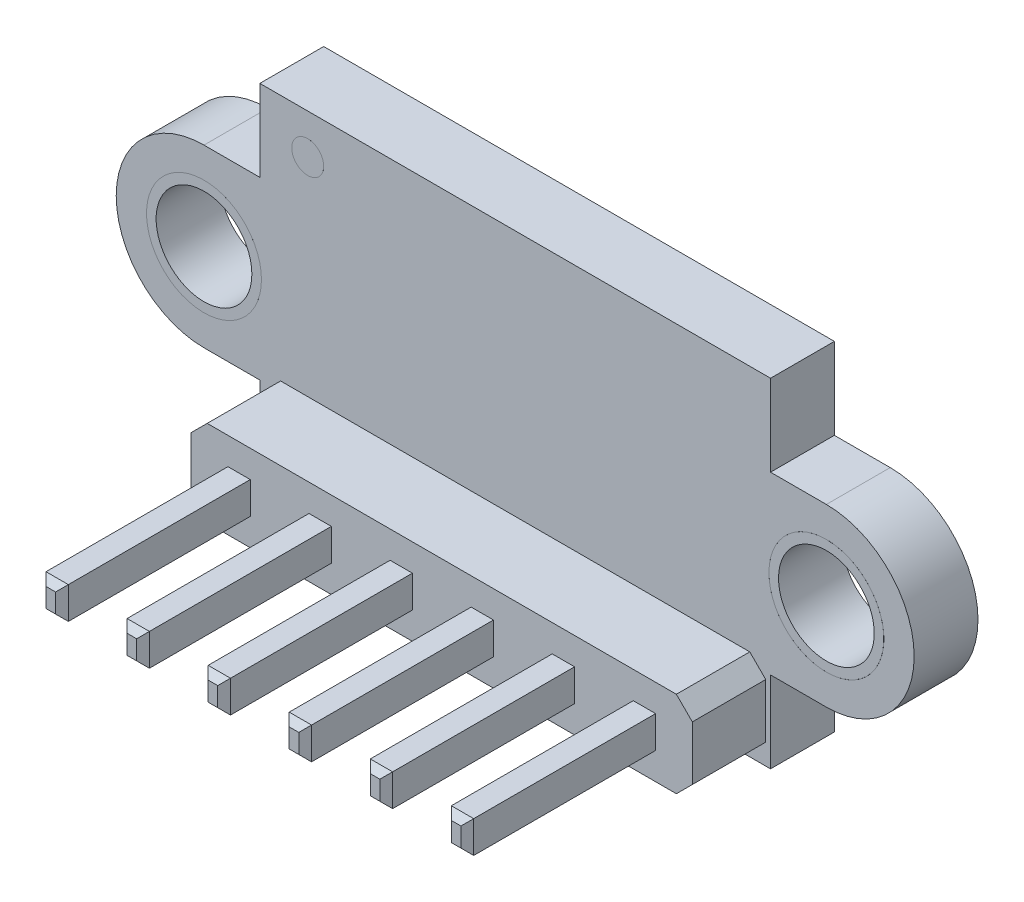
from build123d import *

# Parameters (mm, degrees)
SKETCH1_W                = 16
SKETCH1_H                = 10.6
BOSS_EXTRUDE1_DEPTH      = 1
SKETCH2_R                = 1.5
BOSS_EXTRUDE2_DEPTH      = 1
BOSS_EXTRUDE9_START      = 0.0001
SKETCH9_R                = 1.8
SKETCH9_R_2              = 1.5
SKETCH9_R_3              = 0.5
BOSS_EXTRUDE9_DEPTH      = 0.0001
SKETCH3_W                = 15.7
SKETCH3_H                = 2.7
BOSS_EXTRUDE3_DEPTH      = 2.3
CHAMFER1_SIZE            = 0.5
BOSS_EXTRUDE4_DEPTH      = 5.9
BOSS_EXTRUDE4_DEPTH_BACK = 6
SKETCH4_W                = 0.7
SKETCH4_H                = 1
CHAMFER3_SIZE            = 0.4
CHAMFER2_SIZE            = 0.2
SKETCH6_W                = 4.4
SKETCH6_H                = 2.4
BOSS_EXTRUDE6_DEPTH      = 1.2
SKETCH8_R                = 0.15
SKETCH8_R_2              = 0.05
CUT_EXTRUDE1_DEPTH       = 0.01
SKETCH5_W                = 4.8
SKETCH5_H                = 2.8
SKETCH5_W_2              = 4.6
SKETCH5_H_2              = 2.6
INSCRI_ES_DEPTH          = 0.0001


with BuildPart() as part:
    # Sketch1 → Boss-Extrude1 (new, symmetric)
    with BuildSketch(Plane.XY):
        Rectangle(SKETCH1_W, SKETCH1_H)
    extrude(amount=BOSS_EXTRUDE1_DEPTH, both=True)

    # Sketch2 → Boss-Extrude2 (add, symmetric)
    # profile 1 of 2: a face of its own
    with BuildSketch(Plane.XY):
        with BuildLine():
            Line((-9.75, 2.75), (-8, 2.75))
            Line((-8, 2.75), (-8, -2.75))
            Line((-8, -2.75), (-9.75, -2.75))
            ThreePointArc((-9.75, -2.75), (-12.5, 0), (-9.75, 2.75))
        make_face()
        with Locations((-9.75, 0)):
            Circle(SKETCH2_R, mode=Mode.SUBTRACT)
    # profile 2 of 2: a face of its own
    with BuildSketch(Plane.XY):
        with BuildLine():
            Line((9.75, -2.75), (8, -2.75))
            Line((8, -2.75), (8, 2.75))
            Line((8, 2.75), (9.75, 2.75))
            ThreePointArc((9.75, 2.75), (12.5, 0), (9.75, -2.75))
        make_face()
        with Locations(Location((9.75, 0, 0), (0, 0, 180))):
            Circle(SKETCH2_R, mode=Mode.SUBTRACT)
    extrude(amount=BOSS_EXTRUDE2_DEPTH, both=True)

    # Sketch9 → Boss-Extrude9 (add)
    # profile 1 of 3: a face of its own
    with BuildSketch(Plane(origin=(0, 0, -1), x_dir=(-1, 0, 0), z_dir=(0, 0, -1)).offset(BOSS_EXTRUDE9_START)):
        with Locations(Location((-9.75, 0, 0), (0, 0, 180))):
            Circle(SKETCH9_R)
        with Locations((-9.75, 0)):
            Circle(SKETCH9_R_2, mode=Mode.SUBTRACT)
    # profile 2 of 3: a face of its own
    with BuildSketch(Plane(origin=(0, 0, -1), x_dir=(-1, 0, 0), z_dir=(0, 0, -1)).offset(BOSS_EXTRUDE9_START)):
        with Locations(Location((9.75, 0, 0), (0, 0, 180))):
            Circle(SKETCH9_R)
        with Locations(Location((9.75, 0, 0), (0, 0, 180))):
            Circle(SKETCH9_R_2, mode=Mode.SUBTRACT)
    # profile 3 of 3: a face of its own
    with BuildSketch(Plane(origin=(0, 0, -1), x_dir=(-1, 0, 0), z_dir=(0, 0, -1)).offset(BOSS_EXTRUDE9_START)):
        with Locations(Location((6.5, 4.05, 0), (0, 0, 180))):
            Circle(SKETCH9_R_3)
    boss_extrude9 = extrude(amount=-BOSS_EXTRUDE9_DEPTH)

    # Mirror4: Boss-Extrude9 across plane
    add(boss_extrude9.mirror(Plane.XY))

    # Sketch3 → Boss-Extrude3 (add)
    with BuildSketch(Plane.XY.offset(1)):
        with Locations((0, -3.8)):
            Rectangle(SKETCH3_W, SKETCH3_H)
    extrude(amount=BOSS_EXTRUDE3_DEPTH)

    # Chamfer1
    chamfer1_edges = [part.edges().sort_by_distance(p)[0] for p in [
        (-7.85, -2.45, 2.15),
        (-7.85, -5.15, 2.15),
        (7.85, -5.15, 2.15),
        (7.85, -2.45, 2.15),
    ]]
    chamfer(chamfer1_edges, length=CHAMFER1_SIZE)

    # Sketch4 → Boss-Extrude4 (add, two sides: drawn at the far end of the back side and taken through both)
    with BuildSketch(Plane.XY.offset(3.3).offset(-BOSS_EXTRUDE4_DEPTH_BACK)):
        with Locations((-3.81, -3.8)):
            Rectangle(SKETCH4_W, SKETCH4_H)
        with Locations((-6.35, -3.8)):
            Rectangle(SKETCH4_W, SKETCH4_H)
        with Locations((-1.27, -3.8)):
            Rectangle(SKETCH4_W, SKETCH4_H)
        with Locations((1.27, -3.8)):
            Rectangle(SKETCH4_W, SKETCH4_H)
        with Locations((3.81, -3.8)):
            Rectangle(SKETCH4_W, SKETCH4_H)
        with Locations((6.35, -3.8)):
            Rectangle(SKETCH4_W, SKETCH4_H)
    extrude(amount=BOSS_EXTRUDE4_DEPTH + BOSS_EXTRUDE4_DEPTH_BACK)

    # Chamfer3
    chamfer3_edges = [part.edges().sort_by_distance(p)[0] for p in [
        (-6.7, -3.8, -1),
        (-6.35, -3.3, -1),
        (-6, -3.8, -1),
        (-6.35, -4.3, -1),
        (-4.16, -3.8, -1),
        (-3.81, -3.3, -1),
        (-3.46, -3.8, -1),
        (-3.81, -4.3, -1),
        (-1.62, -3.8, -1),
        (-1.27, -3.3, -1),
        (-0.92, -3.8, -1),
        (-1.27, -4.3, -1),
        (0.92, -3.8, -1),
        (1.27, -3.3, -1),
        (1.62, -3.8, -1),
        (1.27, -4.3, -1),
        (3.46, -3.8, -1),
        (3.81, -3.3, -1),
        (4.16, -3.8, -1),
        (3.81, -4.3, -1),
        (6, -3.8, -1),
        (6.35, -3.3, -1),
        (6.7, -3.8, -1),
        (6.35, -4.3, -1),
    ]]
    chamfer(chamfer3_edges, length=CHAMFER3_SIZE)

    # Chamfer2
    chamfer2_edges = [part.edges().sort_by_distance(p)[0] for p in [
        (-6.7, -3.8, -2.7),
        (-6.35, -3.3, -2.7),
        (-6, -3.8, -2.7),
        (-6.35, -4.3, -2.7),
        (-6.7, -3.8, 9.2),
        (-6.35, -4.3, 9.2),
        (-6, -3.8, 9.2),
        (-6.35, -3.3, 9.2),
        (-4.16, -3.8, -2.7),
        (-3.81, -3.3, -2.7),
        (-3.46, -3.8, -2.7),
        (-3.81, -4.3, -2.7),
        (-4.16, -3.8, 9.2),
        (-3.81, -4.3, 9.2),
        (-3.46, -3.8, 9.2),
        (-3.81, -3.3, 9.2),
        (-1.62, -3.8, -2.7),
        (-1.27, -3.3, -2.7),
        (-0.92, -3.8, -2.7),
        (-1.27, -4.3, -2.7),
        (-1.62, -3.8, 9.2),
        (-1.27, -4.3, 9.2),
        (-0.92, -3.8, 9.2),
        (-1.27, -3.3, 9.2),
        (0.92, -3.8, -2.7),
        (1.27, -3.3, -2.7),
        (1.62, -3.8, -2.7),
        (1.27, -4.3, -2.7),
        (0.92, -3.8, 9.2),
        (1.27, -4.3, 9.2),
        (1.62, -3.8, 9.2),
        (1.27, -3.3, 9.2),
        (3.46, -3.8, -2.7),
        (3.81, -3.3, -2.7),
        (4.16, -3.8, -2.7),
        (3.81, -4.3, -2.7),
        (3.46, -3.8, 9.2),
        (3.81, -4.3, 9.2),
        (4.16, -3.8, 9.2),
        (3.81, -3.3, 9.2),
        (6, -3.8, -2.7),
        (6.35, -3.3, -2.7),
        (6.7, -3.8, -2.7),
        (6.35, -4.3, -2.7),
        (6, -3.8, 9.2),
        (6.35, -4.3, 9.2),
        (6.7, -3.8, 9.2),
        (6.35, -3.3, 9.2),
    ]]
    chamfer(chamfer2_edges, length=CHAMFER2_SIZE)

    # Sketch6 → Boss-Extrude6 (add)
    with BuildSketch(Plane(origin=(0, 0, -1), x_dir=(-1, 0, 0), z_dir=(0, 0, -1))):
        with Locations((0, 2.1)):
            Rectangle(SKETCH6_W, SKETCH6_H)
    extrude(amount=BOSS_EXTRUDE6_DEPTH)

    # Sketch8 → Cut-Extrude1 (cut)
    with BuildSketch(Plane(origin=(0, 0, -2.2), x_dir=(-1, 0, 0), z_dir=(0, 0, -1))):
        with Locations((-1.55, 2.1)):
            Circle(SKETCH8_R)
        with Locations((1.65, 2.1)):
            Circle(SKETCH8_R_2)
    extrude(amount=-CUT_EXTRUDE1_DEPTH, mode=Mode.SUBTRACT)

    # Sketch5 → Inscrições (add)
    # profile 1 of 12: a face of its own
    with BuildSketch(Plane(origin=(0, 0, -1), x_dir=(-1, 0, 0), z_dir=(0, 0, -1))):
        with Locations((0, 2.1)):
            Rectangle(SKETCH5_W, SKETCH5_H)
        with Locations((0, 2.1)):
            Rectangle(SKETCH5_W_2, SKETCH5_H_2, mode=Mode.SUBTRACT)
    # profile 2 of 12: a face of its own
    with BuildSketch(Plane(origin=(0, 0, -1), x_dir=(-1, 0, 0), z_dir=(0, 0, -1))):
        Polygon((-3.145569905, 4.655439852), (-3.07345452, 4.655439852), (-2.82345452, 4.064394179), (-2.57345452, 4.655439852), (-2.501339136, 4.655439852), (-2.818646828, 3.905439852), (-2.828262213, 3.905439852), align=None)
    # profile 3 of 12: a face of its own
    with BuildSketch(Plane(origin=(0, 0, -1), x_dir=(-1, 0, 0), z_dir=(0, 0, -1))):
        Polygon((-2.366723751, 4.655439852), (-2.299416059, 4.655439852), (-2.299416059, 3.982362929), (-2.01095452, 3.982362929), (-2.01095452, 3.905439852), (-2.366723751, 3.905439852), align=None)
    # profile 4 of 12: a face of its own
    with BuildSketch(Plane(origin=(0, 0, -1), x_dir=(-1, 0, 0), z_dir=(0, 0, -1))):
        with BuildLine():
            Line((-1.482108366, 4.655439852), (-1.482108366, 4.578516775))
            Line((-1.482108366, 4.578516775), (-1.73721654, 4.578516775))
            Line((-1.73721654, 4.578516775), (-1.777631203, 4.38125115))
            add(Edge.make_bspline(
                [(-1.777631203, 4.38125115), (-1.769690658, 4.383443351), (-1.754307109, 4.387690394), (-1.731601425, 4.392405916), (-1.710045953, 4.395248511), (-1.696058373, 4.395636649), (-1.689289857, 4.395824467)],
                knots=[0, 0, 0, 0, 1.100273476, 2.13160584, 3.095893838, 4, 4, 4, 4], degree=3))
            add(Edge.make_bspline(
                [(-1.689289857, 4.395824467), (-1.68091477, 4.395643195), (-1.664447256, 4.395286769), (-1.640353196, 4.39186423), (-1.61735329, 4.386477106), (-1.59549564, 4.37895128), (-1.574739807, 4.369327765), (-1.555276758, 4.35730635), (-1.536814348, 4.343263493), (-1.519683793, 4.327118133), (-1.504142869, 4.309349215), (-1.490478729, 4.290243957), (-1.478872459, 4.26998803), (-1.469538012, 4.248387899), (-1.462084226, 4.225682366), (-1.457123084, 4.201632527), (-1.453819504, 4.176465073), (-1.453450421, 4.159256951), (-1.453262213, 4.150481919)],
                knots=[0, 0, 0, 0, 1.052922333, 2.070308379, 3.05430497, 4.020497103, 4.973039431, 5.925935799, 6.892292201, 7.88610001, 8.88166317, 9.857072816, 10.836096531, 11.812156883, 12.81219415, 13.836441305, 14.89672472, 16, 16, 16, 16], degree=3))
            add(Edge.make_bspline(
                [(-1.453262213, 4.150481919), (-1.453404729, 4.144370015), (-1.453687835, 4.132228803), (-1.455127532, 4.114197903), (-1.457899472, 4.096548725), (-1.461621127, 4.079278926), (-1.466451645, 4.062421204), (-1.472299299, 4.045927305), (-1.479455591, 4.029899889), (-1.487305171, 4.014187304), (-1.496143702, 3.999144767), (-1.505953382, 3.985077127), (-1.516317416, 3.971773353), (-1.527469142, 3.959376124), (-1.539512212, 3.947966906), (-1.552300776, 3.937477989), (-1.565732788, 3.927731989), (-1.580016054, 3.919124519), (-1.5948323, 3.911203885), (-1.61039549, 3.904705985), (-1.626351354, 3.898896586), (-1.642929542, 3.894265973), (-1.660092501, 3.890637568), (-1.677868525, 3.888173154), (-1.696164383, 3.886378203), (-1.708566171, 3.886265841), (-1.714830722, 3.886209083)],
                knots=[0, 0, 0, 0, 1.056347294, 2.098418968, 3.122841568, 4.141288669, 5.149314143, 6.15115421, 7.162517403, 8.180376062, 9.185164535, 10.17417709, 11.141909838, 12.097768115, 13.052685741, 14.0056014, 14.954263652, 15.917497458, 16.885230207, 17.854509472, 18.828990115, 19.81800267, 20.826176721, 21.857883937, 22.917946725, 24, 24, 24, 24], degree=3))
            add(Edge.make_bspline(
                [(-1.714830722, 3.886209083), (-1.722303761, 3.886357119), (-1.737006082, 3.886648364), (-1.758546203, 3.889695182), (-1.779270762, 3.894058879), (-1.799012926, 3.900623794), (-1.817949626, 3.908849643), (-1.835825922, 3.919245965), (-1.853098589, 3.931027202), (-1.869065454, 3.944930134), (-1.883884621, 3.960126352), (-1.897150301, 3.976617275), (-1.908964639, 3.994130727), (-1.919138442, 4.01275176), (-1.927816589, 4.032431445), (-1.934634087, 4.053243517), (-1.940136592, 4.075079232), (-1.942464467, 4.090112127), (-1.943646828, 4.097747544)],
                knots=[0, 0, 0, 0, 1.0467383, 2.05933395, 3.04377827, 4.011590433, 4.970194871, 5.932262533, 6.905835911, 7.896367577, 8.894135286, 9.877477877, 10.858688626, 11.851381753, 12.8477658, 13.868841284, 14.917554742, 16, 16, 16, 16], degree=3))
            Line((-1.943646828, 4.097747544), (-1.876339136, 4.097747544))
            add(Edge.make_bspline(
                [(-1.876339136, 4.097747544), (-1.874683016, 4.090595447), (-1.871499863, 4.07684872), (-1.864512917, 4.057534861), (-1.855970229, 4.040323599), (-1.845812154, 4.024987259), (-1.833694291, 4.011613903), (-1.819866556, 3.999695961), (-1.804363472, 3.988944148), (-1.787136352, 3.979982126), (-1.76896212, 3.972338822), (-1.749940575, 3.967249173), (-1.730589644, 3.96367041), (-1.717501422, 3.963312176), (-1.710924472, 3.96313216)],
                knots=[0, 0, 0, 0, 1.136247022, 2.183929868, 3.172523383, 4.106158343, 5.02341133, 5.958108904, 6.928429099, 7.938127109, 8.96079061, 9.975095812, 10.982467395, 12, 12, 12, 12], degree=3))
            add(Edge.make_bspline(
                [(-1.710924472, 3.96313216), (-1.704504806, 3.963308041), (-1.691864429, 3.963654352), (-1.673261989, 3.966319854), (-1.655302088, 3.970425048), (-1.63816194, 3.976568588), (-1.62154161, 3.984035314), (-1.605861516, 3.993617116), (-1.590668043, 4.004644263), (-1.576433443, 4.017277826), (-1.563396418, 4.031199904), (-1.551877249, 4.046087916), (-1.542282196, 4.061970098), (-1.534196316, 4.078571488), (-1.528056323, 4.096074036), (-1.523676113, 4.114395716), (-1.521104029, 4.133581783), (-1.520750204, 4.146668064), (-1.520569905, 4.153336487)],
                knots=[0, 0, 0, 0, 1.027316725, 2.022795036, 3.002884548, 3.971462791, 4.93288096, 5.914575861, 6.907176829, 7.935150275, 8.956128384, 9.956726525, 10.942570165, 11.921478529, 12.907843606, 13.90538589, 14.932640048, 16, 16, 16, 16], degree=3))
            add(Edge.make_bspline(
                [(-1.520569905, 4.153336487), (-1.520711008, 4.159352719), (-1.520987196, 4.171128638), (-1.523243747, 4.188357039), (-1.527168812, 4.204658406), (-1.532616787, 4.220111456), (-1.539533824, 4.234730765), (-1.547986605, 4.248531421), (-1.558133762, 4.261331528), (-1.569724881, 4.273137075), (-1.582423033, 4.284032405), (-1.596446692, 4.293320424), (-1.61150239, 4.30113412), (-1.627408733, 4.307877263), (-1.644544069, 4.31272028), (-1.662569061, 4.316356255), (-1.681678356, 4.318459547), (-1.694743503, 4.318751381), (-1.701459328, 4.31890139)],
                knots=[0, 0, 0, 0, 1.045622112, 2.046656509, 3.013763289, 3.955457236, 4.890082067, 5.820317437, 6.762574623, 7.722996705, 8.69280354, 9.665887285, 10.63943826, 11.638615906, 12.663482002, 13.728887084, 14.832589034, 16, 16, 16, 16], degree=3))
            add(Edge.make_bspline(
                [(-1.701459328, 4.31890139), (-1.70727267, 4.318776978), (-1.719275746, 4.318520098), (-1.73768778, 4.316628706), (-1.757036007, 4.313577428), (-1.777246256, 4.309380375), (-1.798379222, 4.303888002), (-1.820390308, 4.297306323), (-1.843325793, 4.289437323), (-1.858779591, 4.283494706), (-1.866723751, 4.280439852)],
                knots=[0, 0, 0, 0, 0.817624296, 1.688186739, 2.600797293, 3.572016777, 4.590301741, 5.671205678, 6.80286297, 8, 8, 8, 8], degree=3))
            Line((-1.866723751, 4.280439852), (-1.789800674, 4.655439852))
            Line((-1.789800674, 4.655439852), (-1.482108366, 4.655439852))
        make_face()
    # profile 5 of 12: a face of its own
    with BuildSketch(Plane(origin=(0, 0, -1), x_dir=(-1, 0, 0), z_dir=(0, 0, -1))):
        with BuildLine():
            Line((-1.28018529, 4.482362929), (-1.347492982, 4.482362929))
            add(Edge.make_bspline(
                [(-1.347492982, 4.482362929), (-1.345669507, 4.489912747), (-1.342104762, 4.504672023), (-1.334669568, 4.525759294), (-1.326569727, 4.545714334), (-1.316843491, 4.564163493), (-1.306234472, 4.581477543), (-1.294079603, 4.597263784), (-1.280939662, 4.611923705), (-1.266405745, 4.624933685), (-1.251163889, 4.636714627), (-1.234999327, 4.646759282), (-1.218237279, 4.655400172), (-1.200761607, 4.662518793), (-1.182520285, 4.667881405), (-1.163678223, 4.671772149), (-1.144186044, 4.674298817), (-1.130954417, 4.674545409), (-1.12423577, 4.674670621)],
                knots=[0, 0, 0, 0, 1.162005537, 2.271625781, 3.343758855, 4.383309926, 5.390229558, 6.379919256, 7.361854164, 8.333198761, 9.295911338, 10.242430842, 11.177959212, 12.116337295, 13.062827104, 14.020064771, 14.994644689, 16, 16, 16, 16], degree=3))
            add(Edge.make_bspline(
                [(-1.12423577, 4.674670621), (-1.114446611, 4.674375072), (-1.095081823, 4.67379042), (-1.066632599, 4.668451612), (-1.03919828, 4.660003369), (-1.013079156, 4.648330428), (-0.988818063, 4.633933147), (-0.967231738, 4.616797846), (-0.948612771, 4.597255138), (-0.932992547, 4.575669589), (-0.92076219, 4.552600551), (-0.911743682, 4.52885766), (-0.906253321, 4.504497238), (-0.905541774, 4.488049249), (-0.90518529, 4.479808842)],
                knots=[0, 0, 0, 0, 1.083050992, 2.142477498, 3.193116406, 4.255571735, 5.30263384, 6.308962982, 7.297363603, 8.282367274, 9.249857812, 10.179914175, 11.08814088, 12, 12, 12, 12], degree=3))
            add(Edge.make_bspline(
                [(-0.90518529, 4.479808842), (-0.90543463, 4.471878815), (-0.905922552, 4.456360982), (-0.910065489, 4.433706375), (-0.917037545, 4.412354604), (-0.926695351, 4.392215783), (-0.939197112, 4.373417603), (-0.954341262, 4.35591777), (-0.972234689, 4.339638664), (-0.985794462, 4.330313063), (-0.992775434, 4.325511967)],
                knots=[0, 0, 0, 0, 1.024540389, 2.004866551, 2.965041327, 3.920577974, 4.882998113, 5.874504559, 6.905732034, 8, 8, 8, 8], degree=3))
            add(Edge.make_bspline(
                [(-0.992775434, 4.325511967), (-0.984797201, 4.321659502), (-0.968990013, 4.314026654), (-0.947443471, 4.299057563), (-0.927883927, 4.28177406), (-0.916975987, 4.268286349), (-0.911495386, 4.261509563)],
                knots=[0, 0, 0, 0, 1.015518401, 2.012035669, 3.001164323, 4, 4, 4, 4], degree=3))
            add(Edge.make_bspline(
                [(-0.911495386, 4.261509563), (-0.907886527, 4.256568617), (-0.900727906, 4.246767635), (-0.89189172, 4.231009829), (-0.883875481, 4.215077367), (-0.877629006, 4.198543209), (-0.872791749, 4.181598991), (-0.869334027, 4.164215621), (-0.867185997, 4.146378902), (-0.866878379, 4.134311942), (-0.866723751, 4.128246342)],
                knots=[0, 0, 0, 0, 1.025084078, 2.033381695, 3.024893161, 4.013698104, 4.991890475, 5.976764909, 6.982997093, 8, 8, 8, 8], degree=3))
            add(Edge.make_bspline(
                [(-0.866723751, 4.128246342), (-0.86710829, 4.117744259), (-0.867875557, 4.096789516), (-0.874733573, 4.065830647), (-0.885364982, 4.035568039), (-0.900462897, 4.006623431), (-0.918863077, 3.979541921), (-0.940753932, 3.955311283), (-0.965886734, 3.934483011), (-0.993916516, 3.917080819), (-1.024284472, 3.903169836), (-1.056764956, 3.893514669), (-1.090889968, 3.887226241), (-1.114291532, 3.886551912), (-1.126188895, 3.886209083)],
                knots=[0, 0, 0, 0, 0.955779014, 1.907060117, 2.875433937, 3.871313158, 4.872415639, 5.851225146, 6.836215519, 7.83643374, 8.849228613, 9.86973379, 10.916971861, 12, 12, 12, 12], degree=3))
            add(Edge.make_bspline(
                [(-1.126188895, 3.886209083), (-1.134207317, 3.886395128), (-1.149984896, 3.886761204), (-1.173179932, 3.889263762), (-1.195320296, 3.893834477), (-1.216435924, 3.899985185), (-1.236545575, 3.907783416), (-1.255587883, 3.917494565), (-1.273680003, 3.928918459), (-1.290651207, 3.942189942), (-1.306499471, 3.957035943), (-1.320803627, 3.973720017), (-1.333802154, 3.991933746), (-1.345147005, 4.011888687), (-1.355354923, 4.033326956), (-1.363750842, 4.056523063), (-1.371140607, 4.081269639), (-1.37457635, 4.098514869), (-1.376339136, 4.107362929)],
                knots=[0, 0, 0, 0, 1.048658725, 2.063410685, 3.046034179, 4.001477787, 4.936774919, 5.862367409, 6.792675028, 7.730719943, 8.675894397, 9.627829632, 10.600096036, 11.597688215, 12.626045268, 13.701542398, 14.82072376, 16, 16, 16, 16], degree=3))
            Line((-1.376339136, 4.107362929), (-1.309031443, 4.107362929))
            add(Edge.make_bspline(
                [(-1.309031443, 4.107362929), (-1.307277881, 4.10158814), (-1.30386705, 4.090355675), (-1.298061129, 4.074189895), (-1.291446499, 4.059370312), (-1.284350522, 4.045788215), (-1.276897998, 4.033309843), (-1.268559085, 4.022265157), (-1.259951411, 4.012169042), (-1.253462979, 4.006480911), (-1.250287453, 4.003697063)],
                knots=[0, 0, 0, 0, 1.198163088, 2.33053128, 3.407730985, 4.417276592, 5.372219308, 6.28897303, 7.162600585, 8, 8, 8, 8], degree=3))
            add(Edge.make_bspline(
                [(-1.250287453, 4.003697063), (-1.246088187, 4.000459563), (-1.237702616, 3.993994557), (-1.224037995, 3.985744208), (-1.209666948, 3.978595416), (-1.194278089, 3.973134624), (-1.178203496, 3.96851084), (-1.161183346, 3.965485014), (-1.143367799, 3.963408978), (-1.131203279, 3.963225778), (-1.124986972, 3.96313216)],
                knots=[0, 0, 0, 0, 0.946170439, 1.889420265, 2.845303464, 3.807233317, 4.801018734, 5.828864929, 6.890507805, 8, 8, 8, 8], degree=3))
            add(Edge.make_bspline(
                [(-1.124986972, 3.96313216), (-1.117968365, 3.963264139), (-1.104244083, 3.963522214), (-1.084218042, 3.96589558), (-1.065166446, 3.969352097), (-1.047300819, 3.974690593), (-1.030387139, 3.98128649), (-1.0146625, 3.989568291), (-0.999920477, 3.999285017), (-0.98634989, 4.010329123), (-0.974147281, 4.022419443), (-0.9634031, 4.035065101), (-0.954269244, 4.048212779), (-0.946901334, 4.061935234), (-0.941083359, 4.07617564), (-0.937122673, 4.09097396), (-0.934368777, 4.106209089), (-0.934144503, 4.116565296), (-0.934031443, 4.121786006)],
                knots=[0, 0, 0, 0, 1.217147791, 2.380027433, 3.494444702, 4.572153297, 5.609568379, 6.639424714, 7.649109417, 8.668170816, 9.669597737, 10.625200337, 11.543417969, 12.441394052, 13.322311151, 14.205496177, 15.095365482, 16, 16, 16, 16], degree=3))
            add(Edge.make_bspline(
                [(-0.934031443, 4.121786006), (-0.934359365, 4.12877415), (-0.935013577, 4.142715666), (-0.940008273, 4.163226575), (-0.948223743, 4.182988734), (-0.959724996, 4.201664975), (-0.973725509, 4.218974097), (-0.990089418, 4.234417986), (-1.00895261, 4.247161577), (-1.02631401, 4.255966289), (-1.041692258, 4.261974234), (-1.054852697, 4.265976012), (-1.069586255, 4.269364652), (-1.085714759, 4.272517282), (-1.103359734, 4.275200428), (-1.12250197, 4.27743796), (-1.143145348, 4.279228326), (-1.157436312, 4.280027846), (-1.164800674, 4.280439852)],
                knots=[0, 0, 0, 0, 1.07054697, 2.135767047, 3.216561865, 4.33974944, 5.486079747, 6.621378074, 7.775625952, 8.963672916, 9.598146892, 10.304877434, 11.070270905, 11.915000392, 12.823868403, 13.805723172, 14.86925407, 16, 16, 16, 16], degree=3))
            Line((-1.164800674, 4.280439852), (-1.164800674, 4.357362929))
            add(Edge.make_bspline(
                [(-1.164800674, 4.357362929), (-1.155521853, 4.357520387), (-1.137346922, 4.357828808), (-1.110798142, 4.361559096), (-1.085411004, 4.366719231), (-1.06174813, 4.3746232), (-1.040180549, 4.383803264), (-1.021469206, 4.39448588), (-1.005876245, 4.40636047), (-0.993477444, 4.419610314), (-0.984149753, 4.433820682), (-0.977329725, 4.448631394), (-0.973301083, 4.464172264), (-0.972763297, 4.474778265), (-0.972492982, 4.480109323)],
                knots=[0, 0, 0, 0, 1.321986639, 2.589447074, 3.816329219, 5.01088745, 6.139805852, 7.153945165, 8.075214402, 8.924034688, 9.728124013, 10.488707548, 11.240355623, 12, 12, 12, 12], degree=3))
            add(Edge.make_bspline(
                [(-0.972492982, 4.480109323), (-0.972581784, 4.484025983), (-0.972758452, 4.491817991), (-0.97498644, 4.503201935), (-0.978334449, 4.514237852), (-0.982937248, 4.524878811), (-0.989098005, 4.535051013), (-0.996470717, 4.54484118), (-1.005249595, 4.554193419), (-1.015309334, 4.56291063), (-1.026111863, 4.571218324), (-1.037951101, 4.578271246), (-1.050470074, 4.584302331), (-1.063682643, 4.589275795), (-1.077631685, 4.593017071), (-1.092251662, 4.595703323), (-1.107570451, 4.59738282), (-1.118021537, 4.597624624), (-1.123334328, 4.597747544)],
                knots=[0, 0, 0, 0, 0.884392785, 1.759457502, 2.611959086, 3.489218968, 4.37281399, 5.2945488, 6.255912374, 7.266815255, 8.301784654, 9.332968512, 10.37626691, 11.440494194, 12.520033166, 13.637162961, 14.798855837, 16, 16, 16, 16], degree=3))
            add(Edge.make_bspline(
                [(-1.123334328, 4.597747544), (-1.131873971, 4.597449395), (-1.14855388, 4.596867041), (-1.172599934, 4.591766395), (-1.194954077, 4.583628234), (-1.212040934, 4.573914016), (-1.224658629, 4.564324637), (-1.233675115, 4.55594984), (-1.24252951, 4.546642807), (-1.250639298, 4.535830298), (-1.258840865, 4.524244557), (-1.266307557, 4.511296625), (-1.273563205, 4.497324255), (-1.27793518, 4.487446619), (-1.28018529, 4.482362929)],
                knots=[0, 0, 0, 0, 1.472543308, 2.876219568, 4.221790263, 5.565193594, 6.249813518, 6.953379497, 7.687249741, 8.463570142, 9.283606569, 10.136032583, 11.040678096, 12, 12, 12, 12], degree=3))
        make_face()
    # profile 6 of 12: a face of its own
    with BuildSketch(Plane(origin=(0, 0, -1), x_dir=(-1, 0, 0), z_dir=(0, 0, -1))):
        Polygon((-0.732108366, 4.655439852), (-0.664800674, 4.655439852), (-0.664800674, 3.982362929), (-0.376339136, 3.982362929), (-0.376339136, 3.905439852), (-0.732108366, 3.905439852), align=None)
    # profile 7 of 12: a face of its own
    with BuildSketch(Plane(origin=(0, 0, -1), x_dir=(-1, 0, 0), z_dir=(0, 0, -1))):
        with BuildLine():
            add(Edge.make_bspline(
                [(-0.318646828, 4.280139371), (-0.318576538, 4.29216024), (-0.31844, 4.315510951), (-0.316921052, 4.349536231), (-0.314397765, 4.381456293), (-0.310939756, 4.411272665), (-0.306731618, 4.438993043), (-0.301114013, 4.464543348), (-0.294725556, 4.488041835), (-0.28732146, 4.509565131), (-0.278966934, 4.52940321), (-0.269873878, 4.547922896), (-0.259681422, 4.565096167), (-0.248972084, 4.581197122), (-0.237312354, 4.5959622), (-0.225034042, 4.609599913), (-0.211657926, 4.621795074), (-0.197638709, 4.632904996), (-0.182849467, 4.642644169), (-0.167711753, 4.651222613), (-0.152121373, 4.658551156), (-0.136035762, 4.664313392), (-0.1195995, 4.669072859), (-0.102755129, 4.672327633), (-0.085474836, 4.674375542), (-0.073810957, 4.674571328), (-0.067895626, 4.674670621)],
                knots=[0, 0, 0, 0, 1.646270934, 3.197905019, 4.663502075, 6.030701355, 7.308322542, 8.50163776, 9.611534131, 10.641858119, 11.616356847, 12.558055219, 13.465016945, 14.349605745, 15.204443733, 16.039544428, 16.859896111, 17.680448484, 18.487036065, 19.28249412, 20.06191084, 20.843045899, 21.620316918, 22.403196591, 23.190181807, 24, 24, 24, 24], degree=3))
            add(Edge.make_bspline(
                [(-0.067895626, 4.674670621), (-0.061930881, 4.674566089), (-0.050068879, 4.674358208), (-0.032531656, 4.672360221), (-0.015399581, 4.66904498), (0.001254306, 4.664347628), (0.017566803, 4.658519983), (0.033410319, 4.651215601), (0.048883265, 4.642712987), (0.063739755, 4.632722156), (0.078142887, 4.621583097), (0.091738879, 4.608991096), (0.104528969, 4.595073299), (0.116673677, 4.579978614), (0.127828448, 4.563417524), (0.138451327, 4.545678072), (0.14795962, 4.52645003), (0.15711705, 4.506054215), (0.165021405, 4.483926289), (0.172149886, 4.460190983), (0.177909665, 4.434567943), (0.182707366, 4.407191604), (0.186424129, 4.377961429), (0.189131124, 4.346940076), (0.190561071, 4.314107135), (0.190830364, 4.291659025), (0.190968557, 4.280139371)],
                knots=[0, 0, 0, 0, 0.810914788, 1.612654377, 2.396697861, 3.181598691, 3.963628158, 4.749916497, 5.551656086, 6.361998678, 7.18212741, 8.025565596, 8.878627764, 9.750805457, 10.657531673, 11.591944965, 12.560506719, 13.57287815, 14.630710178, 15.753379473, 16.941251878, 18.199788006, 19.531962791, 20.947069417, 22.433333509, 24, 24, 24, 24], degree=3))
            add(Edge.make_bspline(
                [(0.190968557, 4.280139371), (0.190828931, 4.268669962), (0.190556877, 4.246322287), (0.189147154, 4.213637078), (0.186370305, 4.182780354), (0.182896736, 4.153678112), (0.178085815, 4.12645148), (0.172170422, 4.101006241), (0.165602496, 4.077232511), (0.15749504, 4.055325052), (0.148621317, 4.034978254), (0.138966632, 4.015978151), (0.128623098, 3.998156802), (0.117354081, 3.981656856), (0.105342635, 3.96636143), (0.09233168, 3.952540511), (0.078687984, 3.939861081), (0.064242466, 3.928578589), (0.049154276, 3.918703274), (0.033734474, 3.909871735), (0.017709463, 3.902750443), (0.001442402, 3.896635791), (-0.015299391, 3.891964266), (-0.032495046, 3.888734154), (-0.050057096, 3.886468758), (-0.06192886, 3.886295941), (-0.067895626, 3.886209083)],
                knots=[0, 0, 0, 0, 1.561518951, 3.042555995, 4.452378317, 5.7783523, 7.031515105, 8.214008947, 9.334062868, 10.386615937, 11.391082383, 12.354592575, 13.286541444, 14.194233754, 15.072674879, 15.931287219, 16.775624067, 17.606195743, 18.42308326, 19.229000347, 20.022332153, 20.807536673, 21.593273796, 22.3848459, 23.188221202, 24, 24, 24, 24], degree=3))
            add(Edge.make_bspline(
                [(-0.067895626, 3.886209083), (-0.073810793, 3.886309016), (-0.085474349, 3.886506065), (-0.102757011, 3.888544722), (-0.119531821, 3.89182233), (-0.135881554, 3.896411602), (-0.151890093, 3.902029067), (-0.167339297, 3.909347713), (-0.182400943, 3.917776442), (-0.197034848, 3.927375461), (-0.210966026, 3.938372965), (-0.22427287, 3.950536741), (-0.236621088, 3.964170329), (-0.248114108, 3.979058455), (-0.259037127, 3.99506415), (-0.26908485, 4.012405944), (-0.278378605, 4.031015075), (-0.286873638, 4.05101177), (-0.294405495, 4.072687826), (-0.301058575, 4.096291222), (-0.306311609, 4.122030287), (-0.310807956, 4.149698294), (-0.31443461, 4.179414136), (-0.316910537, 4.211193946), (-0.318440819, 4.245017919), (-0.318576905, 4.268218585), (-0.318646828, 4.280139371)],
                knots=[0, 0, 0, 0, 0.810891512, 1.598919785, 2.382837074, 3.152667961, 3.926044502, 4.706494248, 5.493654104, 6.291793342, 7.103789334, 7.925228297, 8.761435821, 9.622817696, 10.50288917, 11.416980706, 12.369136599, 13.353924996, 14.394355917, 15.514179734, 16.714354668, 17.994756427, 19.357759367, 20.818452758, 22.365282078, 24, 24, 24, 24], degree=3))
        make_face()
        with BuildLine():
            add(Edge.make_bspline(
                [(-0.251339136, 4.280439852), (-0.25131354, 4.270422274), (-0.251263863, 4.250980121), (-0.249966106, 4.222727994), (-0.248198199, 4.196377209), (-0.245917921, 4.171894308), (-0.242531575, 4.149362163), (-0.238737264, 4.128625802), (-0.234119816, 4.109794966), (-0.228656598, 4.092740435), (-0.222433934, 4.077172777), (-0.21563982, 4.062686803), (-0.208341094, 4.049111388), (-0.200172705, 4.036568472), (-0.19127662, 4.025017151), (-0.181853778, 4.014252972), (-0.17155251, 4.004653619), (-0.157301708, 3.993140722), (-0.138488178, 3.981243764), (-0.114783795, 3.970883888), (-0.09042627, 3.964373362), (-0.073893859, 3.963545414), (-0.06564202, 3.96313216)],
                knots=[0, 0, 0, 0, 1.459021318, 2.831673884, 4.118529203, 5.306027144, 6.411944654, 7.436330062, 8.375795394, 9.233974572, 10.042671642, 10.816086306, 11.563610507, 12.285937304, 12.993564865, 13.685989202, 14.367179055, 15.041617293, 16.353048772, 17.594441528, 18.799311195, 20, 20, 20, 20], degree=3))
            add(Edge.make_bspline(
                [(-0.06564202, 3.96313216), (-0.057336805, 3.963474541), (-0.040743521, 3.964158598), (-0.016500565, 3.970758327), (0.007034493, 3.980716085), (0.02547848, 3.992490551), (0.039510453, 4.003703764), (0.049564094, 4.013264046), (0.058791676, 4.023968875), (0.067543549, 4.035518724), (0.075570494, 4.048134256), (0.082869738, 4.061754808), (0.089530455, 4.076418203), (0.093325251, 4.086654576), (0.095265432, 4.091888169)],
                knots=[0, 0, 0, 0, 1.353760809, 2.704726607, 4.075137775, 5.516104923, 6.260822281, 7.007110065, 7.778089737, 8.566572457, 9.372053459, 10.217411131, 11.088608312, 12, 12, 12, 12], degree=3))
            add(Edge.make_bspline(
                [(0.095265432, 4.091888169), (0.097526525, 4.098580256), (0.102117513, 4.112168063), (0.108034322, 4.133245988), (0.112694051, 4.155360866), (0.1168862, 4.178380534), (0.119747569, 4.202474756), (0.122050672, 4.227568981), (0.123407248, 4.25368213), (0.123575409, 4.271423914), (0.123660864, 4.280439852)],
                knots=[0, 0, 0, 0, 0.884706709, 1.796334032, 2.740027952, 3.714592787, 4.726048262, 5.777819803, 6.87074269, 8, 8, 8, 8], degree=3))
            add(Edge.make_bspline(
                [(0.123660864, 4.280439852), (0.123542967, 4.289454332), (0.123312334, 4.307088581), (0.122430765, 4.332913906), (0.120154284, 4.357442712), (0.117625902, 4.38078067), (0.113897926, 4.402798592), (0.109878396, 4.4236808), (0.104478136, 4.443168591), (0.098709613, 4.461567073), (0.092107385, 4.478667213), (0.084839728, 4.494548739), (0.077077922, 4.509288323), (0.068647442, 4.522845525), (0.059648367, 4.53528107), (0.049843178, 4.546345626), (0.039620813, 4.556382119), (0.025302844, 4.567838384), (0.006558354, 4.579519461), (-0.016765714, 4.590269267), (-0.041037995, 4.596442472), (-0.057446592, 4.597312834), (-0.06564202, 4.597747544)],
                knots=[0, 0, 0, 0, 1.31362396, 2.569729283, 3.763502607, 4.902122613, 5.988968491, 7.01645872, 7.998833611, 8.933434873, 9.825090667, 10.667526885, 11.477055099, 12.250526234, 12.991942729, 13.710640831, 14.402115721, 15.076753259, 16.378508321, 17.609869233, 18.806226677, 20, 20, 20, 20], degree=3))
            add(Edge.make_bspline(
                [(-0.06564202, 4.597747544), (-0.073937147, 4.597312234), (-0.090542513, 4.596440821), (-0.115067074, 4.590292267), (-0.13857515, 4.579575203), (-0.157270073, 4.567799694), (-0.171598027, 4.556584342), (-0.181687176, 4.546858673), (-0.19114707, 4.53622019), (-0.199861577, 4.524562637), (-0.208023566, 4.512034344), (-0.215519497, 4.498536751), (-0.222273211, 4.484001459), (-0.228505612, 4.468440794), (-0.233985495, 4.451387735), (-0.23850563, 4.432580093), (-0.242681427, 4.411909688), (-0.245637556, 4.389255508), (-0.248265504, 4.364766475), (-0.249954364, 4.338349907), (-0.251268205, 4.310050397), (-0.251315018, 4.29050772), (-0.251339136, 4.280439852)],
                knots=[0, 0, 0, 0, 1.207732386, 2.417664972, 3.655092373, 4.956220595, 5.625982001, 6.301752483, 6.994047911, 7.697131622, 8.419323945, 9.170223765, 9.943494443, 10.752040957, 11.610060368, 12.549350801, 13.567764191, 14.679664412, 15.874934091, 17.154273443, 18.533957287, 20, 20, 20, 20], degree=3))
        make_face(mode=Mode.SUBTRACT)
    # profile 8 of 12: a face of its own
    with BuildSketch(Plane(origin=(0, 0, -1), x_dir=(-1, 0, 0), z_dir=(0, 0, -1))):
        Polygon((0.652507018, 4.674670621), (0.338805095, 3.799670621), (0.267891634, 3.799670621), (0.581593557, 4.674670621), align=None)
    # profile 9 of 12: a face of its own
    with BuildSketch(Plane(origin=(0, 0, -1), x_dir=(-1, 0, 0), z_dir=(0, 0, -1))):
        Polygon((0.869604374, 4.655439852), (1.008276249, 4.655439852), (1.008276249, 3.905439852), (0.940968557, 3.905439852), (0.940968557, 4.578516775), (0.825583941, 4.578516775), align=None)
    # profile 10 of 12: a face of its own
    with BuildSketch(Plane(origin=(0, 0, -1), x_dir=(-1, 0, 0), z_dir=(0, 0, -1))):
        Polygon((1.30154548, 4.655439852), (1.379219759, 4.655439852), (1.575583941, 4.348648987), (1.771948124, 4.655439852), (1.849622403, 4.655439852), (1.614496201, 4.287951871), (1.859237787, 3.905439852), (1.781563509, 3.905439852), (1.575583941, 4.227254756), (1.369604374, 3.905439852), (1.291930095, 3.905439852), (1.536821922, 4.287951871), align=None)
    # profile 11 of 12: a face of its own
    with BuildSketch(Plane(origin=(0, 0, -1), x_dir=(-1, 0, 0), z_dir=(0, 0, -1))):
        Polygon((1.931353172, 4.655439852), (2.003468557, 4.655439852), (2.253468557, 4.064394179), (2.503468557, 4.655439852), (2.575583941, 4.655439852), (2.258276249, 3.905439852), (2.248660864, 3.905439852), align=None)
    # profile 12 of 12: a face of its own
    with BuildSketch(Plane(origin=(0, 0, -1), x_dir=(-1, 0, 0), z_dir=(0, 0, -1))):
        with BuildLine():
            Line((2.73904548, 4.424670621), (2.671737787, 4.424670621))
            add(Edge.make_bspline(
                [(2.671737787, 4.424670621), (2.672176463, 4.433600097), (2.67303801, 4.45113735), (2.677072644, 4.476706759), (2.682845689, 4.501147073), (2.691008143, 4.524262054), (2.701145203, 4.546256084), (2.713301637, 4.567041802), (2.72770032, 4.586539914), (2.744030334, 4.604569666), (2.761766471, 4.62110986), (2.780903458, 4.635393126), (2.801013107, 4.647461199), (2.822034406, 4.657550036), (2.844204527, 4.66512286), (2.867322282, 4.670741783), (2.89148924, 4.674122429), (2.907954959, 4.674485811), (2.916329134, 4.674670621)],
                knots=[0, 0, 0, 0, 1.10065271, 2.161652631, 3.183658789, 4.190468796, 5.17591951, 6.163126047, 7.15150782, 8.156236427, 9.156009102, 10.134482811, 11.092018607, 12.041330605, 13.001268258, 13.972401359, 14.968799086, 16, 16, 16, 16], degree=3))
            add(Edge.make_bspline(
                [(2.916329134, 4.674670621), (2.924553007, 4.674478095), (2.940712623, 4.674099787), (2.964297341, 4.670850995), (2.986749618, 4.665762654), (3.008025568, 4.658623636), (3.027955439, 4.649026973), (3.046688949, 4.637498929), (3.064449122, 4.624166108), (3.08043629, 4.608468863), (3.095116593, 4.591711209), (3.107781362, 4.573820944), (3.11862704, 4.55534324), (3.127667257, 4.536137197), (3.134322144, 4.516021976), (3.139374617, 4.495290433), (3.142230491, 4.473727973), (3.142668796, 4.459133711), (3.142891634, 4.45171389)],
                knots=[0, 0, 0, 0, 1.111607364, 2.184268762, 3.212621178, 4.221274766, 5.211760367, 6.196651075, 7.1921475, 8.207485113, 9.220403448, 10.201281604, 11.166441695, 12.114753415, 13.065576456, 14.026450734, 14.996634279, 16, 16, 16, 16], degree=3))
            add(Edge.make_bspline(
                [(3.142891634, 4.45171389), (3.142528792, 4.441267926), (3.141809475, 4.420559309), (3.135656394, 4.390127552), (3.126046427, 4.360643248), (3.114475565, 4.336913826), (3.102802899, 4.317792363), (3.092284147, 4.302049069), (3.079970259, 4.285097898), (3.065682009, 4.266995611), (3.049714965, 4.247600417), (3.031924502, 4.226924032), (3.012183756, 4.205180082), (2.998328363, 4.190328881), (2.991148845, 4.182633362)],
                knots=[0, 0, 0, 0, 1.184426356, 2.348067706, 3.509069118, 4.696110526, 5.333549288, 6.050745305, 6.844228056, 7.710549037, 8.667450064, 9.695053472, 10.805634456, 12, 12, 12, 12], degree=3))
            Line((2.991148845, 4.182633362), (2.803498605, 3.982362929))
            Line((2.803498605, 3.982362929), (3.152507018, 3.982362929))
            Line((3.152507018, 3.982362929), (3.152507018, 3.905439852))
            Line((3.152507018, 3.905439852), (2.642891634, 3.905439852))
            Line((2.642891634, 3.905439852), (2.933757018, 4.215836487))
            add(Edge.make_bspline(
                [(2.933757018, 4.215836487), (2.940838708, 4.223228981), (2.954441185, 4.237428449), (2.973680309, 4.258159084), (2.990960092, 4.277391128), (3.006392391, 4.295088246), (3.019642428, 4.311509296), (3.031400763, 4.326122447), (3.040821961, 4.339569829), (3.051046689, 4.355157103), (3.060949685, 4.374188314), (3.069459475, 4.397445533), (3.074648371, 4.421387087), (3.075270836, 4.437566095), (3.075583941, 4.445704275)],
                knots=[0, 0, 0, 0, 1.329631726, 2.553950428, 3.673215718, 4.687767853, 5.603093632, 6.413772471, 7.123043292, 7.734684054, 8.834405432, 9.900288307, 10.943827018, 12, 12, 12, 12], degree=3))
            add(Edge.make_bspline(
                [(3.075583941, 4.445704275), (3.075447711, 4.450821718), (3.075179227, 4.460907214), (3.07280972, 4.475694162), (3.069228897, 4.489958051), (3.064097771, 4.503742755), (3.057324898, 4.516909681), (3.049080602, 4.529474855), (3.039568446, 4.54162249), (3.028564602, 4.553012483), (3.016476419, 4.56344417), (3.003706223, 4.572685045), (2.990195486, 4.580407712), (2.976001174, 4.586738461), (2.96116286, 4.591704614), (2.945651843, 4.595145738), (2.929510982, 4.597306271), (2.918489519, 4.597598593), (2.912873605, 4.597747544)],
                knots=[0, 0, 0, 0, 0.991446411, 1.95395049, 2.89581595, 3.838931463, 4.798493298, 5.75982156, 6.748411868, 7.785213223, 8.824556874, 9.840280684, 10.836137867, 11.835679398, 12.848801643, 13.863922112, 14.911575587, 16, 16, 16, 16], degree=3))
            add(Edge.make_bspline(
                [(2.912873605, 4.597747544), (2.907008426, 4.597594323), (2.895490184, 4.597293422), (2.878578963, 4.595188565), (2.862446296, 4.591557314), (2.847051603, 4.586590884), (2.832368834, 4.580278337), (2.818469396, 4.572415821), (2.805384492, 4.563033644), (2.793089522, 4.552396382), (2.781761527, 4.540553324), (2.771808625, 4.527351189), (2.76311205, 4.513031029), (2.755524357, 4.497631482), (2.749362424, 4.481012815), (2.744653892, 4.463234021), (2.740928139, 4.444372297), (2.739683456, 4.431346921), (2.73904548, 4.424670621)],
                knots=[0, 0, 0, 0, 1.031018746, 2.02475058, 2.990194455, 3.934040569, 4.864654155, 5.795059489, 6.735614925, 7.690564532, 8.649604399, 9.611025574, 10.590972636, 11.591080095, 12.624614302, 13.701020113, 14.821632451, 16, 16, 16, 16], degree=3))
        make_face()
    extrude(amount=INSCRI_ES_DEPTH)


solid = part.part
